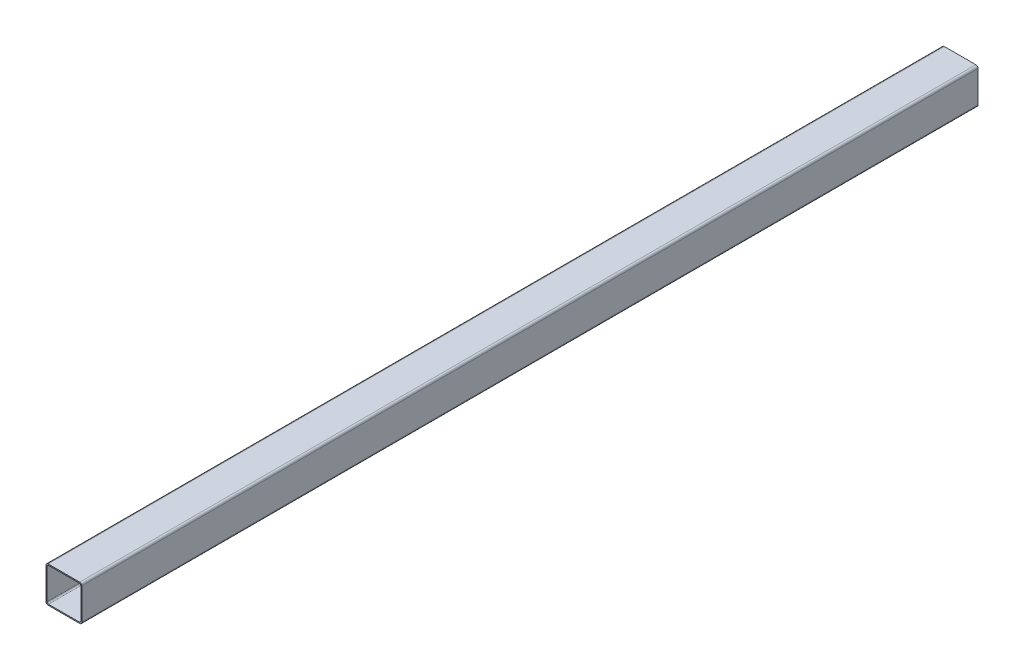
from build123d import *

# Parameters (mm, degrees)
EXTRUDE_1_DEPTH = 2500


with BuildPart() as part:
    # Эскиз1 → Бобышка-Вытянуть1 (new body)
    with BuildSketch(Plane.XY):
        with BuildLine():
            Line((-44, 50), (44, 50))
            ThreePointArc((44, 50), (48.242640687, 48.242640687), (50, 44))
            Line((50, 44), (50, -44))
            ThreePointArc((50, -44), (48.242640687, -48.242640687), (44, -50))
            Line((44, -50), (-44, -50))
            ThreePointArc((-44, -50), (-48.242640687, -48.242640687), (-50, -44))
            Line((-50, -44), (-50, 44))
            ThreePointArc((-50, 44), (-48.242640687, 48.242640687), (-44, 50))
        make_face()
        with BuildLine():
            Line((-43, 47), (43, 47))
            ThreePointArc((43, 47), (45.828427125, 45.828427125), (47, 43))
            Line((47, 43), (47, -43))
            ThreePointArc((47, -43), (45.828427125, -45.828427125), (43, -47))
            Line((43, -47), (-43, -47))
            ThreePointArc((-43, -47), (-45.828427125, -45.828427125), (-47, -43))
            Line((-47, -43), (-47, 43))
            ThreePointArc((-47, 43), (-45.828427125, 45.828427125), (-43, 47))
        make_face(mode=Mode.SUBTRACT)
    extrude(amount=-EXTRUDE_1_DEPTH)


solid = part.part
